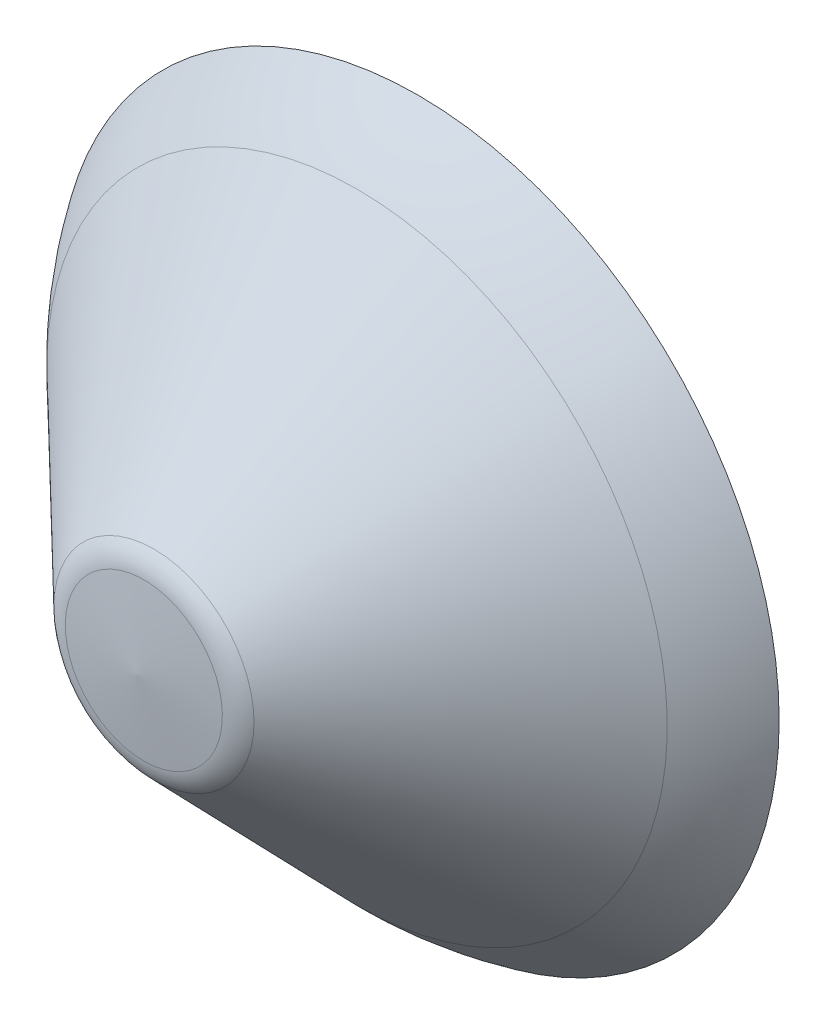
from build123d import *


with BuildPart() as part:
    # Sketch1 → Revolve1 (revolve)
    with BuildSketch(Plane(origin=(0, 0, 0), x_dir=(0, 0, -1), z_dir=(1, 0, 0)), mode=Mode.PRIVATE) as revolve1_sk:
        with BuildLine():
            Line((38.689946481, 49.271967147), (38.689946481, 0))
            Line((38.689946481, 0), (0.292588575, 0))
            ThreePointArc((0.292588575, 0), (0.721383691, 5.362988205), (1.246284081, 10.717424432))
            ThreePointArc((1.246284081, 10.717424432), (1.68863139, 12.303053718), (2.621927019, 13.65909599))
            Line((2.621927019, 13.65909599), (30.337494609, 42.346685411))
            ThreePointArc((30.337494609, 42.346685411), (34.322429223, 46.04003914), (38.689946481, 49.271967147))
        make_face()
    revolve(revolve1_sk.sketch.rotate(Axis((0, 0, -0.292588575), (0, 0, -1)), 180), axis=Axis((0, 0, -0.292588575), (0, 0, -1)))


solid = part.part
